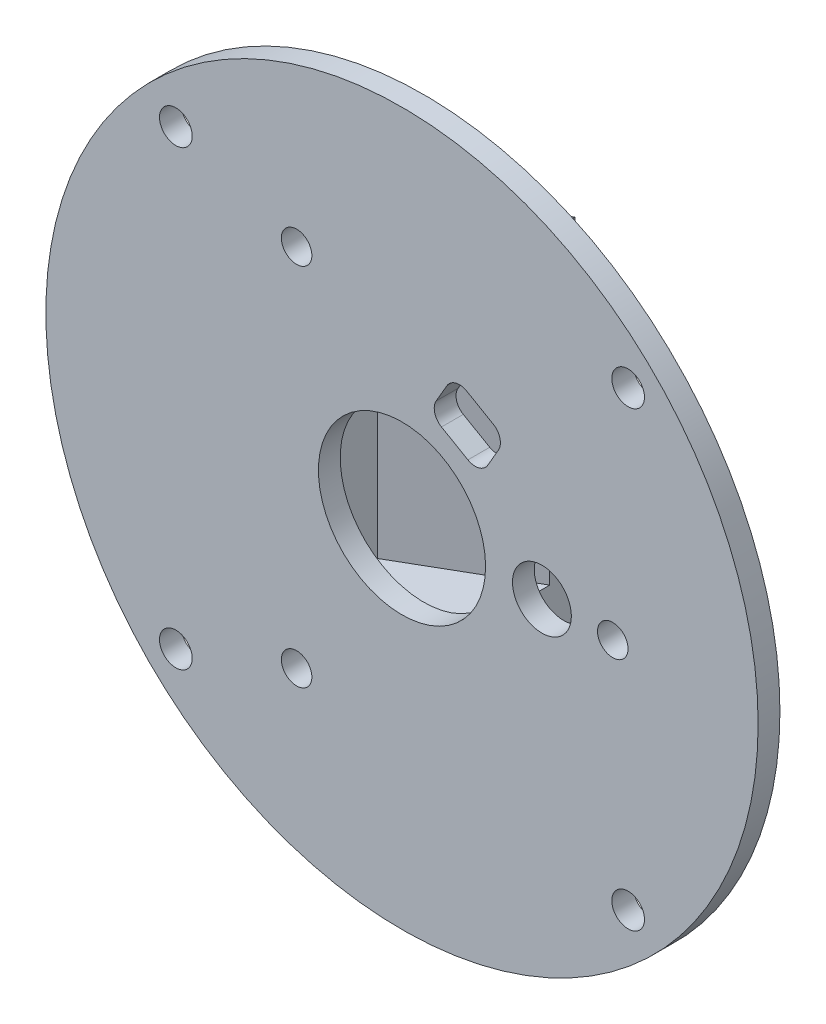
from build123d import *

# Parameters (mm, degrees)
SKETCH_1_R          = 1.6
EXTRUDE_4_DEPTH     = 13
EXTRUDE_4_2_DEPTH   = 13
EXTRUDE_4_3_DEPTH   = 13
EXTRUDE_4_4_DEPTH   = 13
SKETCH_1_R_2        = 2.1
EXTRUDE_4_5_DEPTH   = 13
EXTRUDE_4_6_DEPTH   = 13
EXTRUDE_4_7_DEPTH   = 13
SKETCH_8_R          = 49
EXTRUDE_5_DEPTH     = 3
SKETCH_9_R          = 2.1
CUT_EXTRUDE_2_DEPTH = 13
SKETCH_3_R          = 8.6
CUT_EXTRUDE_3_DEPTH = 13
SKETCH_6_R          = 4.05
CUT_EXTRUDE_4_DEPTH = 13
CUT_EXTRUDE_5_DEPTH = 13
SKETCH_2_R          = 11.5
CUT_EXTRUDE_6_DEPTH = 13
FILLET_1_R          = 2
CUT_EXTRUDE_7_REACH = 71.361
SKETCH_10_R         = 2.25
EXTRUDE_START       = -3
SKETCH_11_R         = 2.1
EXTRUDE_6_DEPTH     = 3
SKETCH_12_W         = 10
SKETCH_12_H         = 48
EXTRUDE_7_DEPTH     = 10
EXTRUDE_8_DEPTH     = 48
SKETCH_16_W         = 15
SKETCH_16_H         = 4
SKETCH_16_W_2       = 11
SKETCH_16_H_2       = 18.11473671
EXTRUDE_9_DEPTH     = 18
CUT_EXTRUDE_8_DEPTH = 48


with BuildPart() as part:
    # 草图1 → 凸台-拉伸4 (new body)
    with BuildSketch(Plane.XY):
        with Locations((0, 44)):
            Circle(SKETCH_1_R)
    extrude(amount=EXTRUDE_4_DEPTH)



with BuildPart() as body_2:
    # 草图1 → Extrude 4 2 (new body)
    with BuildSketch(Plane.XY):
        with Locations((44, 0)):
            Circle(SKETCH_1_R)
    extrude(amount=EXTRUDE_4_2_DEPTH)


with BuildPart() as body_3:
    # 草图1 → Extrude 4 3 (new body)
    with BuildSketch(Plane.XY):
        with Locations((0, -44)):
            Circle(SKETCH_1_R)
    extrude(amount=EXTRUDE_4_3_DEPTH)


with BuildPart() as body_4:
    # 草图1 → Extrude 4 4 (new body)
    with BuildSketch(Plane.XY):
        with Locations((-44, 0)):
            Circle(SKETCH_1_R)
    extrude(amount=EXTRUDE_4_4_DEPTH)


with BuildPart() as body_5:
    # 草图1 → Extrude 4 5 (new body)
    with BuildSketch(Plane.XY):
        with Locations((29, 0)):
            Circle(SKETCH_1_R_2)
    extrude(amount=EXTRUDE_4_5_DEPTH)


with BuildPart() as body_6:
    # 草图1 → Extrude 4 6 (new body)
    with BuildSketch(Plane.XY):
        with Locations((-14.5, 25.11473671)):
            Circle(SKETCH_1_R_2)
    extrude(amount=EXTRUDE_4_6_DEPTH)


with BuildPart() as body_7:
    # 草图1 → Extrude 4 7 (new body)
    with BuildSketch(Plane.XY):
        with Locations((-14.5, -25.11473671)):
            Circle(SKETCH_1_R_2)
    extrude(amount=EXTRUDE_4_7_DEPTH)


with BuildPart() as part_1:
    add(part.part)

    add(body_2.part)  # 凸台-拉伸5 merges body 2

    add(body_3.part)  # 凸台-拉伸5 merges body 3

    add(body_4.part)  # 凸台-拉伸5 merges body 4

    add(body_5.part)  # 凸台-拉伸5 merges body 5

    add(body_6.part)  # 凸台-拉伸5 merges body 6

    add(body_7.part)  # 凸台-拉伸5 merges body 7
    # 草图8 → 凸台-拉伸5 (add)
    with BuildSketch(Plane.XY):
        Circle(SKETCH_8_R)
    extrude(amount=EXTRUDE_5_DEPTH)

    # 草图9 → 切除-拉伸2 (cut)
    with BuildSketch(Plane.XY):
        with Locations((0, 44)):
            Circle(SKETCH_9_R)
        with Locations((44, 0)):
            Circle(SKETCH_9_R)
        with Locations((0, -44)):
            Circle(SKETCH_9_R)
        with Locations((-44, 0)):
            Circle(SKETCH_9_R)
        with Locations((-14.5, 25.11473671)):
            Circle(SKETCH_9_R)
        with Locations((-14.5, -25.11473671)):
            Circle(SKETCH_9_R)
        with Locations((29, 0)):
            Circle(SKETCH_9_R)
    extrude(amount=CUT_EXTRUDE_2_DEPTH, mode=Mode.SUBTRACT)

    # 草图3 → 切除-拉伸3 (cut)
    with BuildSketch(Plane.XY):
        Circle(SKETCH_3_R)
    extrude(amount=CUT_EXTRUDE_3_DEPTH, mode=Mode.SUBTRACT)

    # 草图6 → 切除-拉伸4 (cut)
    with BuildSketch(Plane.XY):
        with Locations((19.25, 0)):
            Circle(SKETCH_6_R)
    extrude(amount=CUT_EXTRUDE_4_DEPTH, mode=Mode.SUBTRACT)

    # 草图7 → 切除-拉伸5 (cut)
    with BuildSketch(Plane.XY):
        Polygon((10.802199699, 10.505830841), (14.272482459, 16.5145615), (7.171657827, 20.615572296), (3.701375067, 14.606841637), align=None)
    extrude(amount=CUT_EXTRUDE_5_DEPTH, mode=Mode.SUBTRACT)

    # 草图2 → 切除-拉伸6 (cut)
    with BuildSketch(Plane.XY):
        Circle(SKETCH_2_R)
    extrude(amount=CUT_EXTRUDE_6_DEPTH, mode=Mode.SUBTRACT)

    # 圆角1
    fillet_1_edges = [part_1.edges().sort_by_distance(p)[0] for p in [
        (7.171657827, 20.615572296, 1.5),
        (3.701375067, 14.606841637, 1.5),
        (10.802199699, 10.505830841, 1.5),
        (14.272482459, 16.5145615, 1.5),
    ]]
    fillet(fillet_1_edges, radius=FILLET_1_R)

    # 草图10 → 切除-拉伸7 (cut, up to next)
    with BuildSketch(Plane.XY.offset(3), mode=Mode.PRIVATE) as cut_extrude_7_sk1:
        with Locations((-31.112698372, 31.112698372)):
            Circle(SKETCH_10_R)
    cut_extrude_7_tool1 = extrude(cut_extrude_7_sk1.sketch, amount=-CUT_EXTRUDE_7_REACH, mode=Mode.PRIVATE) & part_1.part
    # 草图10 → 切除-拉伸7 (cut, up to next)
    with BuildSketch(Plane.XY.offset(3), mode=Mode.PRIVATE) as cut_extrude_7_sk2:
        with Locations((31.112698372, 31.112698372)):
            Circle(SKETCH_10_R)
    cut_extrude_7_tool2 = extrude(cut_extrude_7_sk2.sketch, amount=-CUT_EXTRUDE_7_REACH, mode=Mode.PRIVATE) & part_1.part
    # 草图10 → 切除-拉伸7 (cut, up to next)
    with BuildSketch(Plane.XY.offset(3), mode=Mode.PRIVATE) as cut_extrude_7_sk3:
        with Locations((31.112698372, -31.112698372)):
            Circle(SKETCH_10_R)
    cut_extrude_7_tool3 = extrude(cut_extrude_7_sk3.sketch, amount=-CUT_EXTRUDE_7_REACH, mode=Mode.PRIVATE) & part_1.part
    # 草图10 → 切除-拉伸7 (cut, up to next)
    with BuildSketch(Plane.XY.offset(3), mode=Mode.PRIVATE) as cut_extrude_7_sk4:
        with Locations((-31.112698372, -31.112698372)):
            Circle(SKETCH_10_R)
    cut_extrude_7_tool4 = extrude(cut_extrude_7_sk4.sketch, amount=-CUT_EXTRUDE_7_REACH, mode=Mode.PRIVATE) & part_1.part
    add(cut_extrude_7_tool1.solids().sort_by_distance((-31.112698, 31.112698, 3))[0], mode=Mode.SUBTRACT)
    add(cut_extrude_7_tool2.solids().sort_by_distance((31.112698, 31.112698, 3))[0], mode=Mode.SUBTRACT)
    add(cut_extrude_7_tool3.solids().sort_by_distance((31.112698, -31.112698, 3))[0], mode=Mode.SUBTRACT)
    add(cut_extrude_7_tool4.solids().sort_by_distance((-31.112698, -31.112698, 3))[0], mode=Mode.SUBTRACT)

    # 草图11 → 凸台-拉伸6 (add)
    with BuildSketch(Plane.XY.offset(3).offset(EXTRUDE_START)):
        with Locations((-44, 0)):
            Circle(SKETCH_11_R)
        with Locations((0, -44)):
            Circle(SKETCH_11_R)
        with Locations((44, 0)):
            Circle(SKETCH_11_R)
        with Locations((0, 44)):
            Circle(SKETCH_11_R)
    extrude(amount=EXTRUDE_6_DEPTH)

    # 草图12 → 凸台-拉伸7 (add)
    with BuildSketch(Plane(origin=(0, 0, 0), x_dir=(-1, 0, 0), z_dir=(0, 0, -1))):
        with Locations((31, 0)):
            Rectangle(SKETCH_12_W, SKETCH_12_H)
    extrude(amount=EXTRUDE_7_DEPTH)

    # 草图13 → 凸台-拉伸8 (add)
    with BuildSketch(Plane(origin=(0, 24, 0), x_dir=(1, 0, 0), z_dir=(0, 1, 0))):
        Polygon((0, 20.784609691), (-26, 5.773502692), (-26, 2.309401077), (0, 17.320508076), align=None)
        Polygon((-26, 5.773502692), (-36, 0), (-30, 0), (-26, 2.309401077), align=None)
    extrude(amount=-EXTRUDE_8_DEPTH)

    # 草图16 → 凸台-拉伸9 (add)
    with BuildSketch(Plane(origin=(0, 0, 0), x_dir=(-1, 0, 0), z_dir=(0, 0, -1))):
        with Locations((7.5, -20.11473671)):
            Rectangle(SKETCH_16_W, SKETCH_16_H)
        with Locations((20.5, -20.11473671)):
            Rectangle(SKETCH_16_W_2, SKETCH_16_H)
        with Locations((20.5, -9.057368355)):
            Rectangle(SKETCH_16_W_2, SKETCH_16_H_2)
        with Locations((7.5, 20.11473671)):
            Rectangle(SKETCH_16_W, SKETCH_16_H)
        with Locations((20.5, 20.11473671)):
            Rectangle(SKETCH_16_W_2, SKETCH_16_H)
        with Locations((20.5, 9.057368355)):
            Rectangle(SKETCH_16_W_2, SKETCH_16_H_2)
    extrude(amount=EXTRUDE_9_DEPTH)

    # 草图14 → 切除-拉伸8 (cut)
    with BuildSketch(Plane(origin=(0, 24, 0), x_dir=(1, 0, 0), z_dir=(0, 1, 0))):
        Polygon((0, 20.784609691), (-36, 20.784609691), (-36, 0), align=None)
    extrude(amount=-CUT_EXTRUDE_8_DEPTH, mode=Mode.SUBTRACT)


solid = part_1.part
